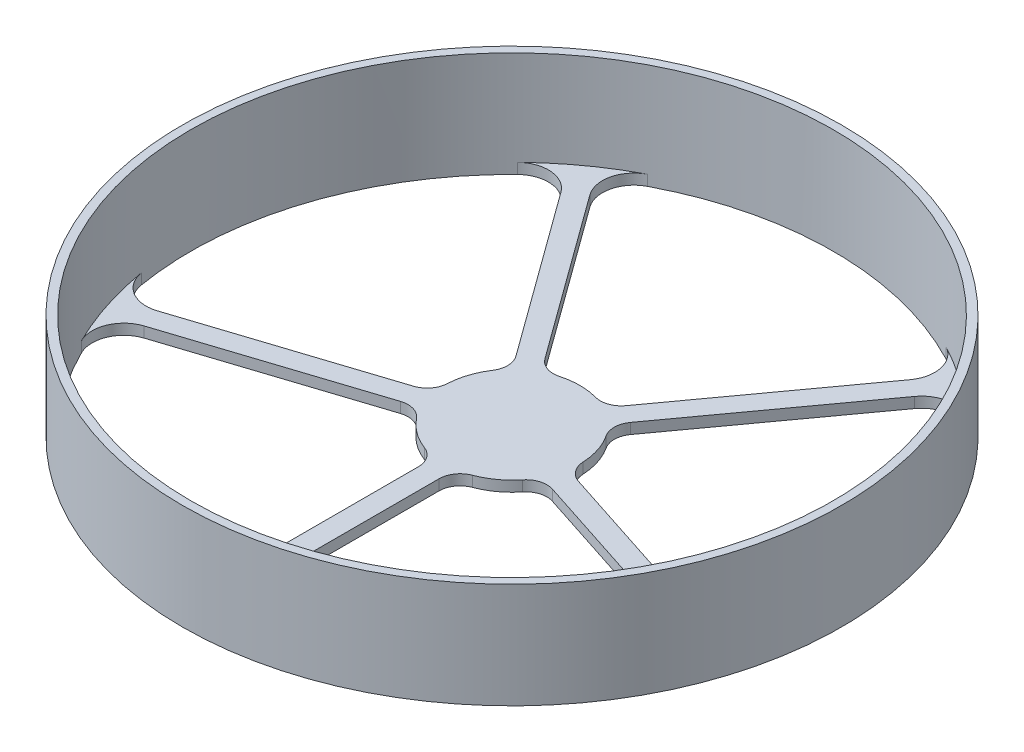
from build123d import *

# Parameters (mm, degrees)
SKETCH1_R           = 16.383937572
BOSS_EXTRUDE1_DEPTH = 2.54
SKETCH2_R           = 79.4512
SKETCH2_R_2         = 77.47
BOSS_EXTRUDE2_DEPTH = 25.4
FILLET2_R           = 7.62
FILLET3_R           = 5.08


with BuildPart() as part:
    # Sketch1 → Boss-Extrude1 (new body)
    with BuildSketch(Plane(origin=(0, 0, 0), x_dir=(1, 0, 0), z_dir=(0, 1, 0))):
        Circle(SKETCH1_R)
        with BuildLine():
            ThreePointArc((-11.540007509, 11.630203655), (-9.630236879, 13.254883931), (-7.494922537, 14.569129917))
            Line((-7.494922537, 14.569129917), (-43.513181009, 64.144009685))
            Line((-43.513181009, 64.144009685), (-47.558265981, 61.205083423))
            Line((-47.558265981, 61.205083423), (-11.540007509, 11.630203655))
        make_face()
        with BuildLine():
            Line((43.513181009, 64.144009685), (7.494922537, 14.569129917))
            ThreePointArc((7.494922537, 14.569129917), (9.630236879, 13.254883931), (11.540007509, 11.630203655))
            Line((11.540007509, 11.630203655), (47.558265981, 61.205083423))
            Line((47.558265981, 61.205083423), (43.513181009, 64.144009685))
        make_face()
        with BuildLine():
            Line((74.450890803, -21.561905263), (16.17212438, -2.62598618))
            ThreePointArc((16.17212438, -2.62598618), (15.582050591, -5.062915145), (14.627039408, -7.381268762))
            Line((14.627039408, -7.381268762), (72.905805831, -26.317187845))
            Line((72.905805831, -26.317187845), (74.450890803, -21.561905263))
        make_face()
        with BuildLine():
            Line((2.5, -77.47), (2.5, -16.19207863))
            ThreePointArc((2.5, -16.19207863), (0, -16.383937572), (-2.5, -16.19207863))
            Line((-2.5, -16.19207863), (-2.5, -77.47))
            Line((-2.5, -77.47), (2.5, -77.47))
        make_face()
        with BuildLine():
            ThreePointArc((-14.627039408, -7.381268762), (-15.582050591, -5.062915145), (-16.17212438, -2.62598618))
            Line((-16.17212438, -2.62598618), (-74.450890803, -21.561905263))
            Line((-74.450890803, -21.561905263), (-72.905805831, -26.317187845))
            Line((-72.905805831, -26.317187845), (-14.627039408, -7.381268762))
        make_face()
    extrude(amount=BOSS_EXTRUDE1_DEPTH)

    # Sketch2 → Boss-Extrude2 (add)
    with BuildSketch(Plane(origin=(0, 0, 0), x_dir=(1, 0, 0), z_dir=(0, 1, 0))):
        with Locations(Location((0, 0, 0), (0, 0, 270))):
            Circle(SKETCH2_R)
        with Locations(Location((0, 0, 0), (0, 0, 124.150712253))):
            Circle(SKETCH2_R_2, mode=Mode.SUBTRACT)
    extrude(amount=BOSS_EXTRUDE2_DEPTH)

    # Fillet2
    fillet2_edges = [part.edges().sort_by_distance(p)[0] for p in [
        (72.867431935, 1.27, 26.30471941),
        (47.534549609, 1.27, -61.172440637),
        (-43.489464637, 1.27, -64.111366899),
        (-74.412516907, 1.27, 21.549436829),
        (-2.5, 1.27, 77.429651297),
        (-47.534549609, 1.27, -61.172440637),
        (43.489464637, 1.27, -64.111366899),
        (74.412516907, 1.27, 21.549436829),
        (2.5, 1.27, 77.429651297),
        (-72.867431935, 1.27, 26.30471941),
    ]]
    fillet(fillet2_edges, radius=FILLET2_R)

    # Fillet3
    fillet3_edges = [part.edges().sort_by_distance(p)[0] for p in [
        (-2.5, 1.27, 16.19207863),
        (-14.627039408, 1.27, 7.381268762),
        (-16.17212438, 1.27, 2.62598618),
        (-11.540007509, 1.27, -11.630203655),
        (-7.494922537, 1.27, -14.569129917),
        (7.494922537, 1.27, -14.569129917),
        (11.540007509, 1.27, -11.630203655),
        (16.17212438, 1.27, 2.62598618),
        (14.627039408, 1.27, 7.381268762),
        (2.5, 1.27, 16.19207863),
    ]]
    fillet(fillet3_edges, radius=FILLET3_R)


solid = part.part
